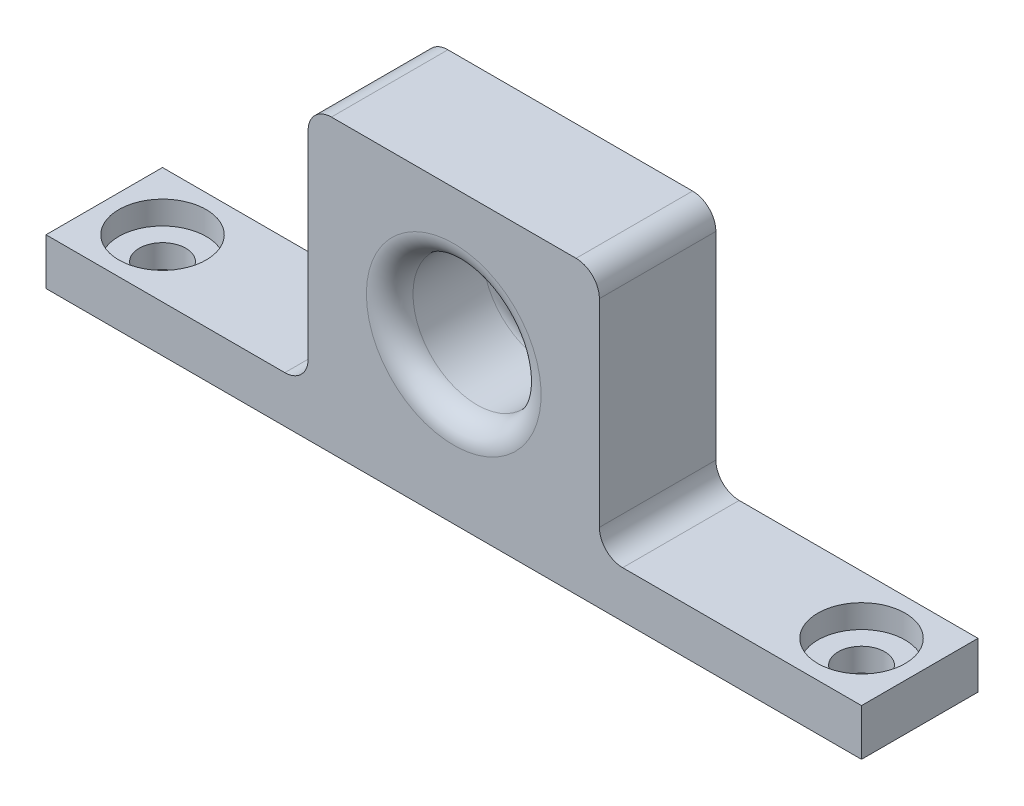
from build123d import *

# Parameters (mm, degrees)
SKETCH1_W           = 88.9
SKETCH1_H           = 12.7
SKETCH1_R           = 2.54
BOSS_EXTRUDE2_DEPTH = 5.08
SKETCH3_R           = 4.7625
CUT_EXTRUDE1_DEPTH  = 2.54
SKETCH4_W           = 31.75
SKETCH4_H           = 31.75
SKETCH4_R           = 6.985
BOSS_EXTRUDE3_DEPTH = 12.7
FILLET1_R           = 2.54


with BuildPart() as part:
    # Sketch1 → Boss-Extrude2 (new body)
    with BuildSketch(Plane(origin=(0, 0, 0), x_dir=(1, 0, 0), z_dir=(0, 1, 0))):
        with Locations((44.45, 6.35)):
            Rectangle(SKETCH1_W, SKETCH1_H)
        with Locations(Location((6.35, 6.35, 0), (0, 0, 270))):
            Circle(SKETCH1_R, mode=Mode.SUBTRACT)
        with Locations(Location((82.55, 6.35, 0), (0, 0, 270))):
            Circle(SKETCH1_R, mode=Mode.SUBTRACT)
    extrude(amount=BOSS_EXTRUDE2_DEPTH)

    # Sketch3 → Cut-Extrude1 (cut)
    with BuildSketch(Plane(origin=(0, 5.08, 0), x_dir=(1, 0, 0), z_dir=(0, 1, 0))):
        with Locations(Location((6.35, 6.35, 0), (0, 0, 270))):
            Circle(SKETCH3_R)
        with Locations(Location((82.55, 6.35, 0), (0, 0, 270))):
            Circle(SKETCH3_R)
    extrude(amount=-CUT_EXTRUDE1_DEPTH, mode=Mode.SUBTRACT)

    # Sketch4 → Boss-Extrude3 (add)
    with BuildSketch(Plane.XY):
        with Locations((44.45, 15.875)):
            Rectangle(SKETCH4_W, SKETCH4_H)
        with Locations((44.45, 16.9545)):
            Circle(SKETCH4_R, mode=Mode.SUBTRACT)
    extrude(amount=-BOSS_EXTRUDE3_DEPTH)

    # Fillet1
    fillet1_edges = [part.edges().sort_by_distance(p)[0] for p in [
        (37.465, 16.9545, -12.7),
        (60.325, 31.75, -6.35),
        (28.575, 5.08, -6.35),
        (28.575, 31.75, -6.35),
        (60.325, 5.08, -6.35),
        (37.465, 16.9545, 0),
    ]]
    fillet(fillet1_edges, radius=FILLET1_R)


solid = part.part
